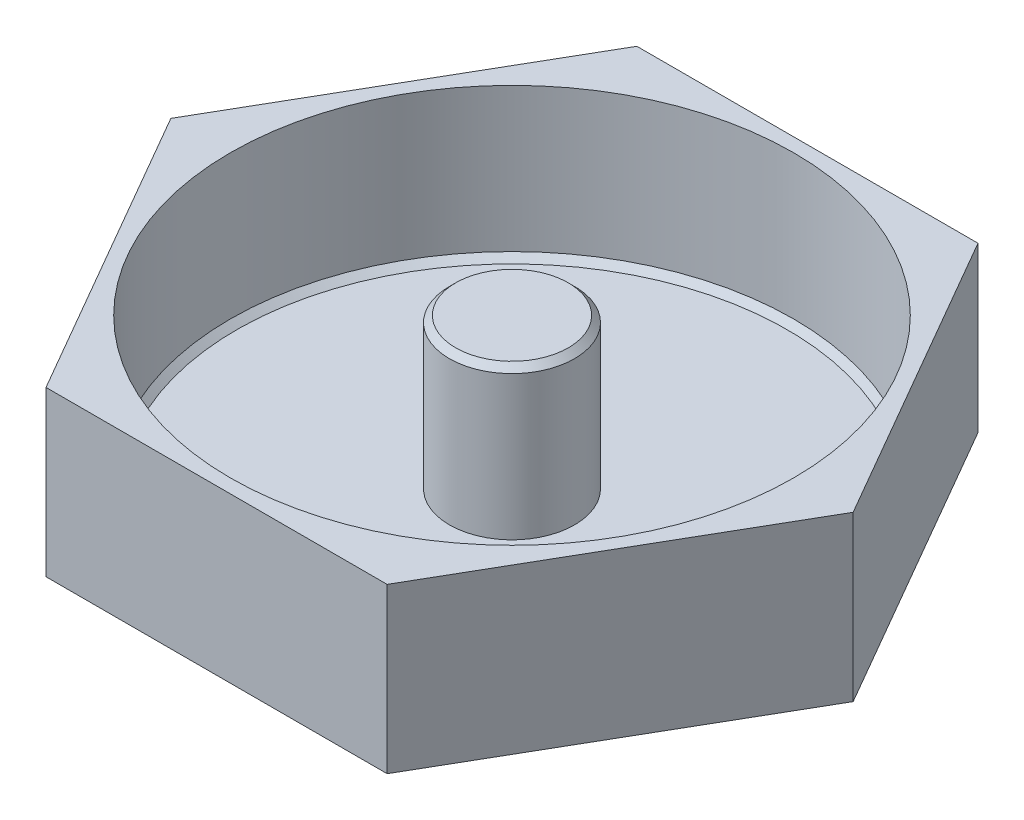
from build123d import *

# Parameters (mm, degrees)
SKETCH1_R             = 22.5
BOSS_EXTRUDE1_DEPTH   = 12
SKETCH1_R_2           = 5
BOSS_EXTRUDE1_2_DEPTH = 12
BOSS_EXTRUDE2_DEPTH   = 1.1
CHAMFER1_SIZE         = 0.5


with BuildPart() as part:
    # Sketch1 → Boss-Extrude1 (new body)
    with BuildSketch(Plane(origin=(0, 0, 0), x_dir=(1, 0, 0), z_dir=(0, 1, 0))):
        Polygon((13.625466353, -23.6), (27.250932706, 0), (13.625466353, 23.6), (-13.625466353, 23.6), (-27.250932706, 0), (-13.625466353, -23.6), align=None)
        with Locations(Location((0, 0, 0), (0, 0, 270))):
            Circle(SKETCH1_R, mode=Mode.SUBTRACT)
    extrude(amount=BOSS_EXTRUDE1_DEPTH)



with BuildPart() as body_2:
    # Sketch1 → Boss-Extrude1 2 (new body)
    with BuildSketch(Plane(origin=(0, 0, 0), x_dir=(1, 0, 0), z_dir=(0, 1, 0))):
        with Locations(Location((0, 0, 0), (0, 0, 270))):
            Circle(SKETCH1_R_2)
    extrude(amount=BOSS_EXTRUDE1_2_DEPTH)


with BuildPart() as part_1:
    add(part.part)

    add(body_2.part)  # Boss-Extrude2 merges body 2
    # Sketch2 → Boss-Extrude2 (add)
    with BuildSketch(Plane.XZ):
        Polygon((-13.625466353, -23.6), (-27.250932706, 0), (-13.625466353, 23.6), (13.625466353, 23.6), (27.250932706, 0), (13.625466353, -23.6), align=None)
    extrude(amount=BOSS_EXTRUDE2_DEPTH)

    # Chamfer1
    chamfer1_edges = [part_1.edges().sort_by_distance(p)[0] for p in [
        (0, 0, -22.5),
        (0, 12, -5),
    ]]
    chamfer(chamfer1_edges, length=CHAMFER1_SIZE)


solid = part_1.part
